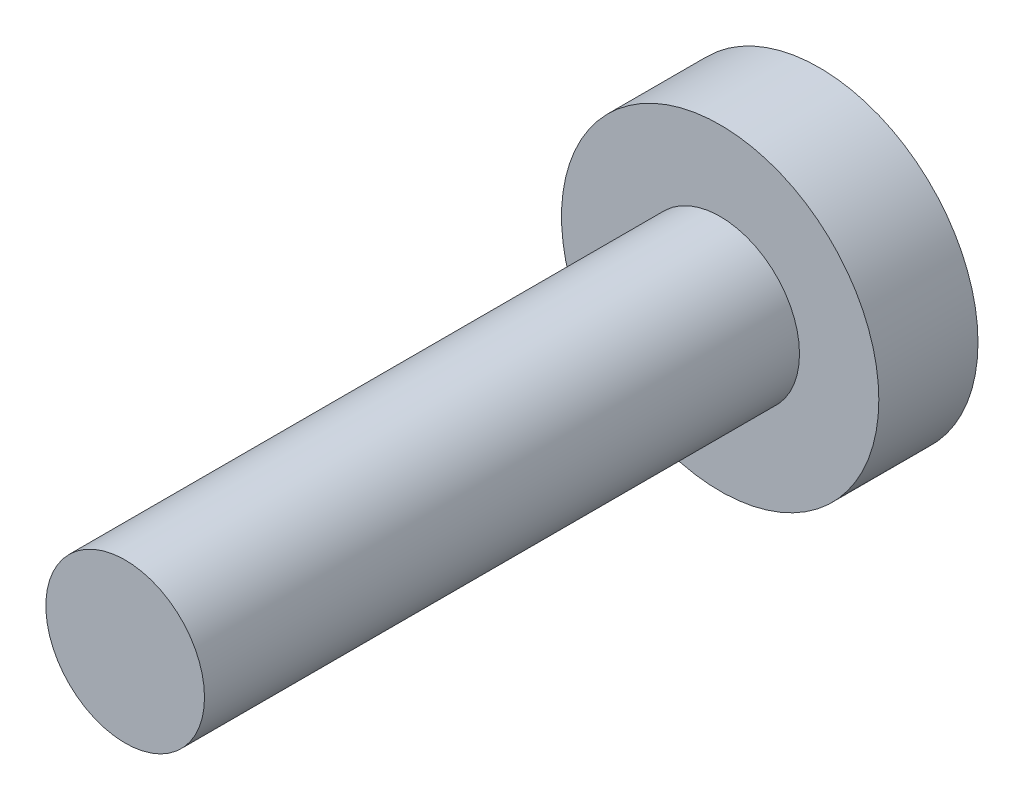
from build123d import *

# Parameters (mm, degrees)
SKETCH1_R           = 8
BOSS_EXTRUDE1_DEPTH = 5
SKETCH2_R           = 4
BOSS_EXTRUDE2_DEPTH = 30


with BuildPart() as part:
    # Sketch1 → Boss-Extrude1 (new body)
    with BuildSketch(Plane.XY):
        Circle(SKETCH1_R)
    extrude(amount=BOSS_EXTRUDE1_DEPTH)

    # Sketch2 → Boss-Extrude2 (add)
    with BuildSketch(Plane.XY.offset(5)):
        Circle(SKETCH2_R)
    extrude(amount=BOSS_EXTRUDE2_DEPTH)


solid = part.part
